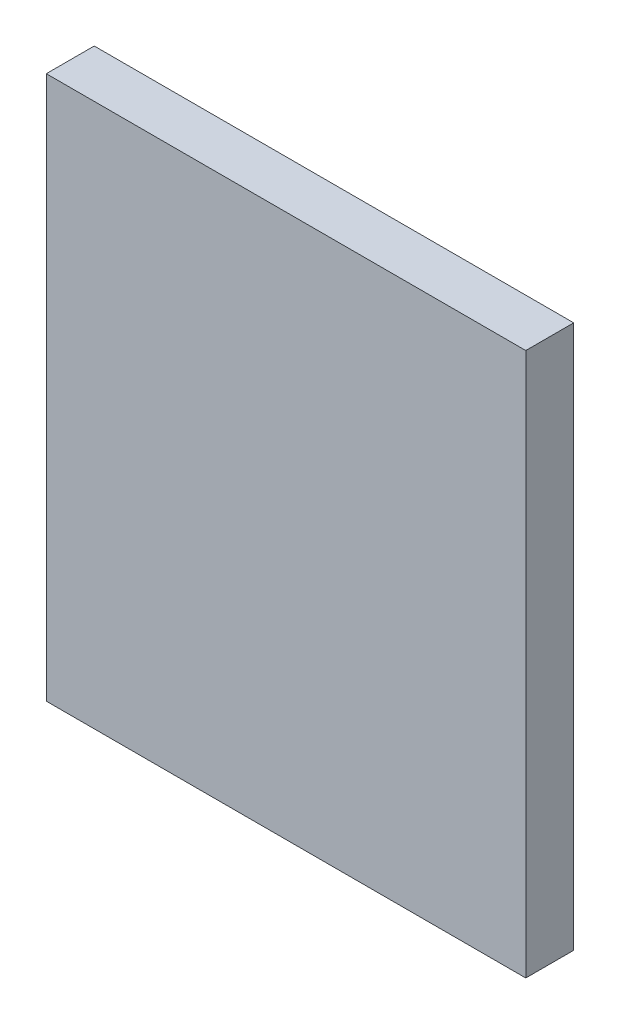
from build123d import *

# Parameters (mm, degrees)
SKETCH1_W           = 60
SKETCH1_H           = 68
BOSS_EXTRUDE1_DEPTH = 6


with BuildPart() as part:
    # Sketch1 → Boss-Extrude1 (new body)
    with BuildSketch(Plane.XY):
        Rectangle(SKETCH1_W, SKETCH1_H)
    extrude(amount=BOSS_EXTRUDE1_DEPTH)


solid = part.part
